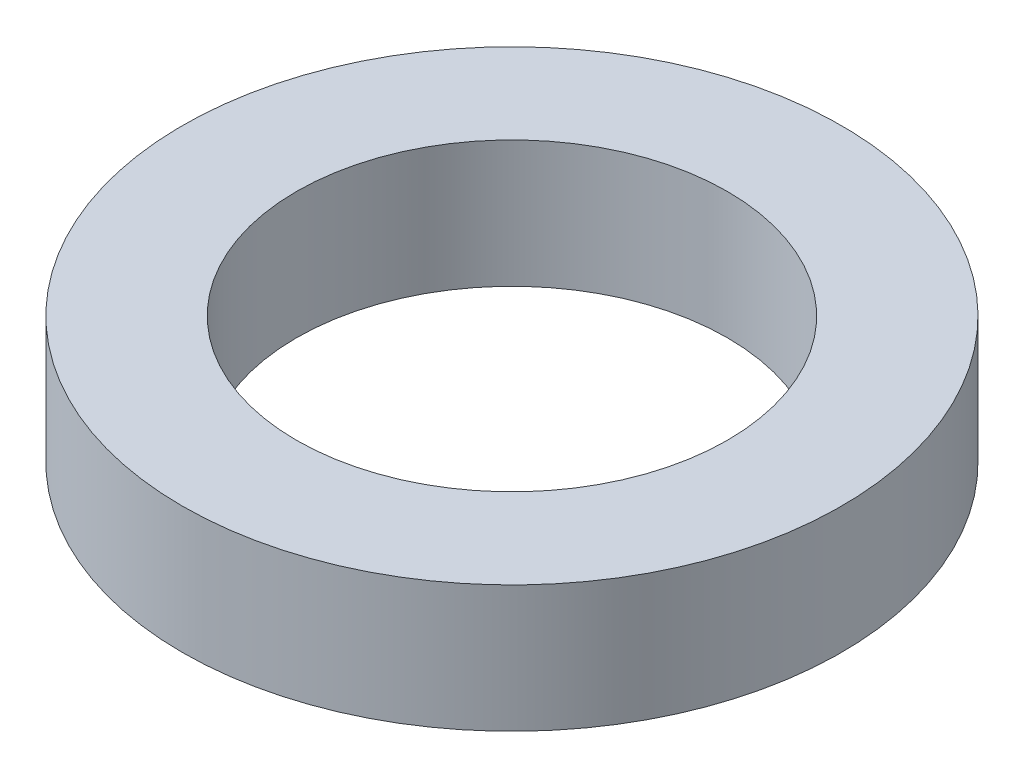
from build123d import *

# Parameters (mm, degrees)
SKETCH_1_R      = 13
SKETCH_1_R_2    = 8.5
EXTRUDE_1_DEPTH = 5


with BuildPart() as part:
    # 草图1 → 凸台-拉伸1 (new body)
    with BuildSketch(Plane(origin=(0, 0, 0), x_dir=(1, 0, 0), z_dir=(0, 1, 0))):
        with Locations(Location((0, 0, 0), (0, 0, 270))):
            Circle(SKETCH_1_R)
        with Locations(Location((0, 0, 0), (0, 0, 270))):
            Circle(SKETCH_1_R_2, mode=Mode.SUBTRACT)
    extrude(amount=EXTRUDE_1_DEPTH)


solid = part.part
